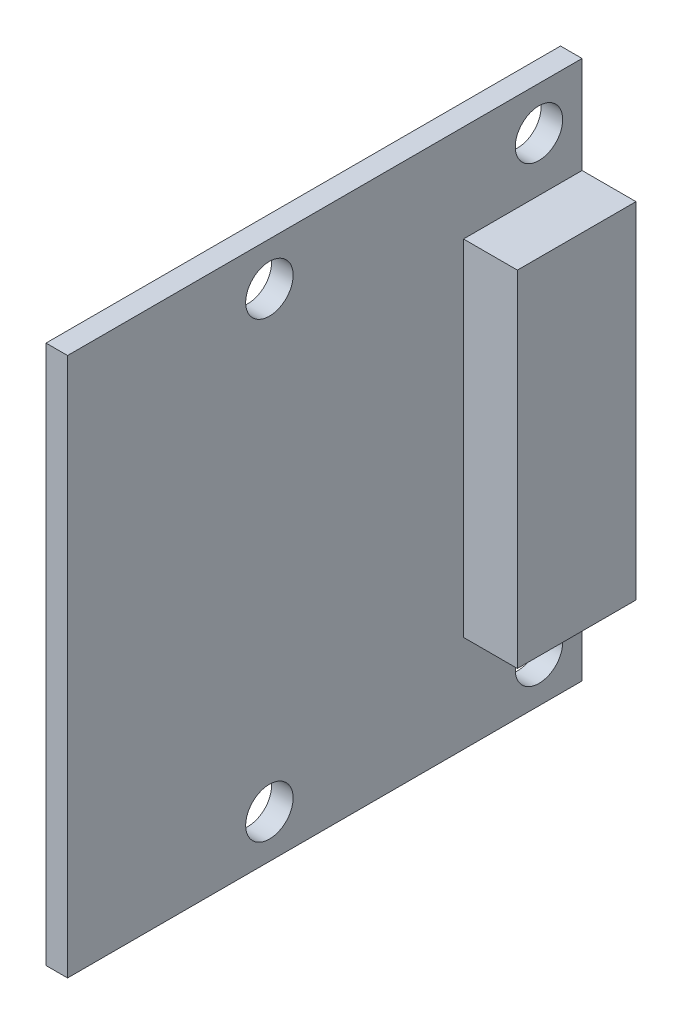
from build123d import *

# Parameters (mm, degrees)
CROQUIS1_W              = 23.86
CROQUIS1_H              = 25
SALIENTE_EXTRUIR1_DEPTH = 1
CROQUIS2_R              = 1.1
CORTAR_EXTRUIR1_DEPTH   = 3
CROQUIS3_W              = 8.5
CROQUIS3_H              = 8.5
SALIENTE_EXTRUIR2_DEPTH = 4.5
CROQUIS4_W              = 5.5
CROQUIS4_H              = 16
SALIENTE_EXTRUIR3_DEPTH = 2.5


with BuildPart() as part:
    # Croquis1 → Saliente-Extruir1 (new body)
    with BuildSketch(Plane(origin=(-16.9, 0, 0), x_dir=(0, 0, -1), z_dir=(1, 0, 0))):
        with Locations((-94.43, 0)):
            Rectangle(CROQUIS1_W, CROQUIS1_H)
    extrude(amount=SALIENTE_EXTRUIR1_DEPTH)

    # Croquis2 → Cortar-Extruir1 (cut)
    with BuildSketch(Plane(origin=(-17.9, 0, 0), x_dir=(0, 0, -1), z_dir=(1, 0, 0))):
        with Locations((-97, -10.5)):
            Circle(CROQUIS2_R)
        with Locations((-84.5, -10.5)):
            Circle(CROQUIS2_R)
        with Locations((-97, 10.5)):
            Circle(CROQUIS2_R)
        with Locations((-84.5, 10.5)):
            Circle(CROQUIS2_R)
    extrude(amount=CORTAR_EXTRUIR1_DEPTH, mode=Mode.SUBTRACT)

    # Croquis3 → Saliente-Extruir2 (add)
    with BuildSketch(Plane(origin=(-21.4, 0, 0), x_dir=(0, 0, -1), z_dir=(1, 0, 0))):
        with Locations((-97, 0)):
            Rectangle(CROQUIS3_W, CROQUIS3_H)
    extrude(amount=SALIENTE_EXTRUIR2_DEPTH)

    # Croquis4 → Saliente-Extruir3 (add)
    with BuildSketch(Plane(origin=(-15.9, 0, 0), x_dir=(0, 0, -1), z_dir=(1, 0, 0))):
        with Locations((-85.25, 0)):
            Rectangle(CROQUIS4_W, CROQUIS4_H)
    extrude(amount=SALIENTE_EXTRUIR3_DEPTH)


solid = part.part
